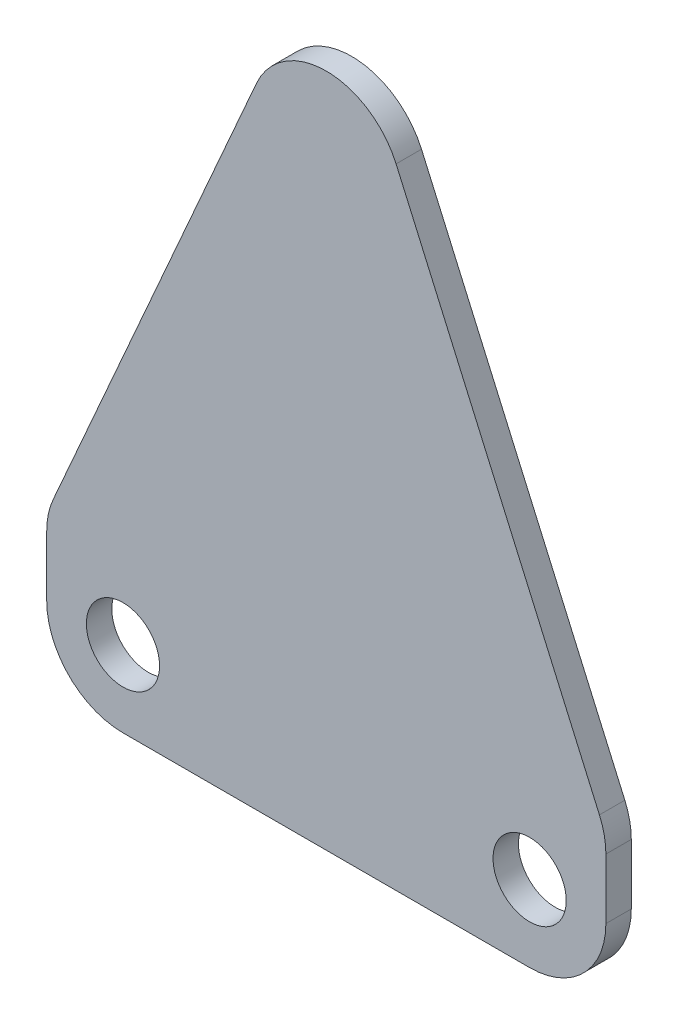
from build123d import *

# Parameters (mm, degrees)
SKETCH1_R           = 2.286
BOSS_EXTRUDE1_DEPTH = 1.5875
FILLET1_R           = 4.7625


with BuildPart() as part:
    # Sketch1 → Boss-Extrude1 (new body)
    with BuildSketch(Plane.XY):
        Polygon((-17.4625, 0), (17.4625, 0), (17.4625, 9.525), (0, 49.2125), (-17.4625, 9.525), align=None)
        with Locations((-12.7, 4.7625)):
            Circle(SKETCH1_R, mode=Mode.SUBTRACT)
        with Locations((12.7, 4.7625)):
            Circle(SKETCH1_R, mode=Mode.SUBTRACT)
    extrude(amount=BOSS_EXTRUDE1_DEPTH)

    # Fillet1
    fillet1_edges = [part.edges().sort_by_distance(p)[0] for p in [
        (-17.4625, 0, 0.79375),
        (-17.4625, 9.525, 0.79375),
        (17.4625, 0, 0.79375),
        (0, 49.2125, 0.79375),
        (17.4625, 9.525, 0.79375),
    ]]
    fillet(fillet1_edges, radius=FILLET1_R)


solid = part.part
